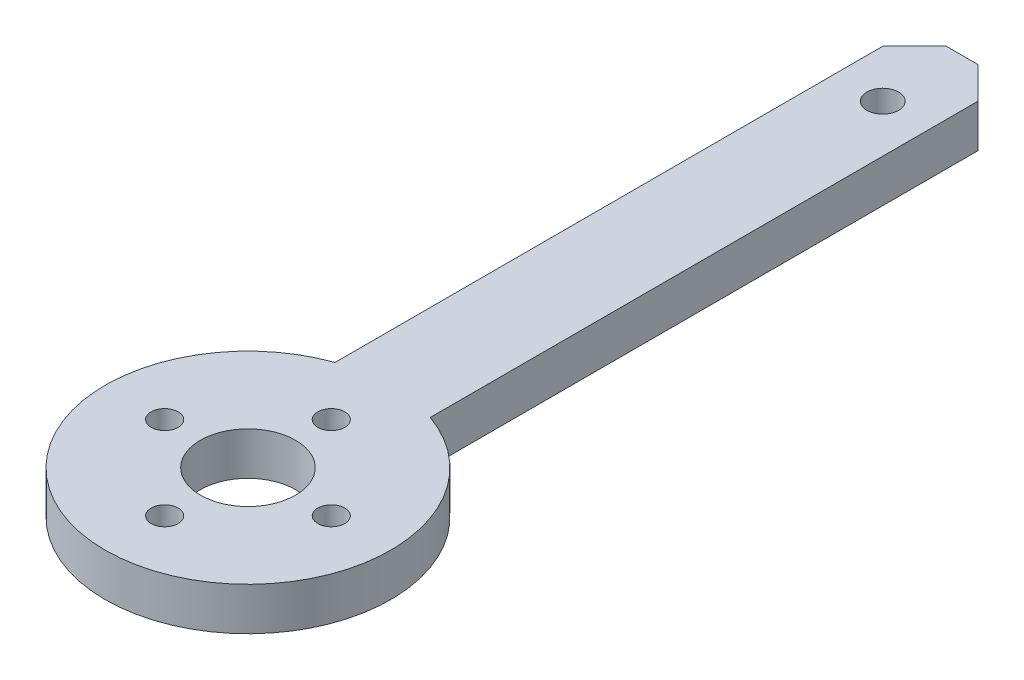
from build123d import *

# Parameters (mm, degrees)
SKETCH1_R           = 18
BOSS_EXTRUDE2_DEPTH = 5.4
SKETCH2_W           = 12
SKETCH2_H           = 90
BOSS_EXTRUDE3_DEPTH = 5.4
SKETCH3_R           = 1.7
SKETCH3_R_2         = 6
CUT_EXTRUDE1_DEPTH  = 92.941068082
CHAMFER1_SIZE       = 4
SKETCH4_R           = 2
CUT_EXTRUDE2_DEPTH  = 92.941068082


with BuildPart() as part:
    # Sketch1 → Boss-Extrude2 (new body)
    with BuildSketch(Plane(origin=(0, 0, 0), x_dir=(1, 0, 0), z_dir=(0, 1, 0))):
        with Locations(Location((0, 0, 0), (0, 0, 90))):
            Circle(SKETCH1_R)
    extrude(amount=BOSS_EXTRUDE2_DEPTH)

    # Sketch2 → Boss-Extrude3 (add)
    with BuildSketch(Plane(origin=(0, 0, 0), x_dir=(1, 0, 0), z_dir=(0, 1, 0))):
        with Locations((0, 45)):
            Rectangle(SKETCH2_W, SKETCH2_H)
    extrude(amount=BOSS_EXTRUDE3_DEPTH)

    # Sketch3 → Cut-Extrude1 (cut, through all)
    with BuildSketch(Plane(origin=(0, 0, 0), x_dir=(1, 0, 0), z_dir=(0, 1, 0))):
        with Locations(Location((10.5, 0, 0), (0, 0, 90))):
            Circle(SKETCH3_R)
        with Locations(Location((0, 0, 0), (0, 0, 90))):
            Circle(SKETCH3_R_2)
        with Locations(Location((0, -10.5, 0), (0, 0, 90))):
            Circle(SKETCH3_R)
        with Locations(Location((-10.5, 0, 0), (0, 0, 90))):
            Circle(SKETCH3_R)
        with Locations(Location((0, 10.5, 0), (0, 0, 90))):
            Circle(SKETCH3_R)
    extrude(amount=CUT_EXTRUDE1_DEPTH, mode=Mode.SUBTRACT)

    # Chamfer1
    chamfer1_edges = [part.edges().sort_by_distance(p)[0] for p in [
        (-6, 2.7, -90),
        (6, 2.7, -90),
    ]]
    chamfer(chamfer1_edges, length=CHAMFER1_SIZE)

    # Sketch4 → Cut-Extrude2 (cut, through all)
    with BuildSketch(Plane(origin=(0, 5.4, 0), x_dir=(1, 0, 0), z_dir=(0, 1, 0))):
        with Locations(Location((0, 80, 0), (0, 0, 270))):
            Circle(SKETCH4_R)
    extrude(amount=-CUT_EXTRUDE2_DEPTH, mode=Mode.SUBTRACT)


solid = part.part
